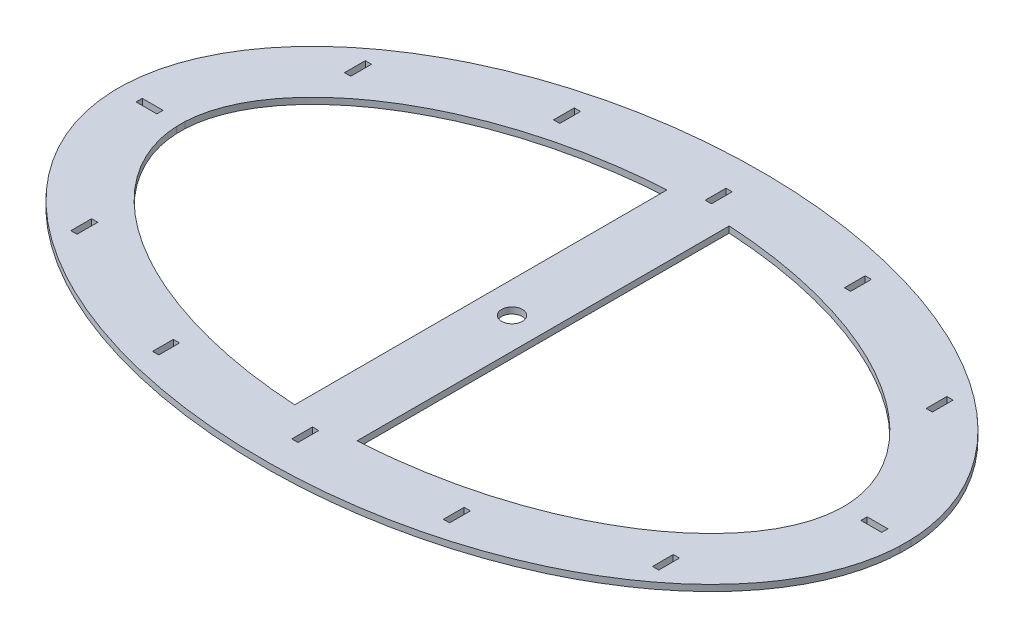
from build123d import *

# Parameters (mm, degrees)
SKETCH_1_R          = 5
EXTRUDE_1_DEPTH     = 3
SKETCH_2_W          = 3
SKETCH_2_H          = 10
SKETCH_2_W_2        = 10
SKETCH_2_H_2        = 3
CUT_EXTRUDE_1_DEPTH = 225.320807502


with BuildPart() as part:
    # 草图1 → 凸台-拉伸1 (new body)
    # profile 1 of 2: a face of its own
    with BuildSketch(Plane(origin=(0, 0, 0), x_dir=(1, 0, 0), z_dir=(0, 1, 0))):
        with BuildLine():
            Line((-189.5, 2.67807522), (-189.5, -2.67807522))
            add(Edge.make_bspline(
                [(-189.5, -2.67807522), (-189.403013737, -5.4287659), (-188.913529521, -11.280436832), (-187.184797767, -20.477000703), (-182.901604371, -32.558534689), (-176.518140993, -44.473382271), (-168.370672682, -55.661029172), (-158.816512899, -65.937496211), (-145.622389947, -77.408485785), (-128.233359888, -89.122185343), (-106.405311843, -100.093014988), (-80.328404186, -109.345622083), (-53.415456511, -115.716654886), (-26.01245021, -119.406694681), (1.612249886, -120.52669773), (29.223526803, -119.1102282), (56.584216313, -115.114894197), (83.419619157, -108.420073225), (109.201033267, -98.876697436), (130.527468144, -87.756954706), (147.425203381, -76.001107817), (160.172847856, -64.598888808), (169.450747209, -54.337956503), (177.420154922, -43.019542435), (183.422267467, -31.306804293), (187.385215446, -19.571139093), (188.958191111, -10.7853005), (189.405454524, -5.359541143), (189.5, -2.67807522)],
                knots=[0, 0, 0, 0, 0, 0.022605252, 0.048189512, 0.076525509, 0.104866865, 0.133209133, 0.161552255, 0.191528088, 0.248214577, 0.304901251, 0.361587924, 0.418274582, 0.474961249, 0.531647919, 0.588334591, 0.645021247, 0.701707888, 0.758394507, 0.813600526, 0.841943986, 0.87028688, 0.898629863, 0.926970611, 0.955317967, 0.977963639, 1, 1, 1, 1, 1], degree=4))
            Line((189.5, -2.67807522), (189.5, 2.67807522))
            add(Edge.make_bspline(
                [(-189.5, 2.67807522), (-189.403013737, 5.4287659), (-188.913529521, 11.280436832), (-187.184797767, 20.477000703), (-182.901604371, 32.558534689), (-176.518140993, 44.473382271), (-168.370672682, 55.661029172), (-158.816512899, 65.937496211), (-145.622389947, 77.408485785), (-128.233359888, 89.122185343), (-106.405311843, 100.093014988), (-80.328404186, 109.345622083), (-53.415456511, 115.716654886), (-26.01245021, 119.406694681), (1.612249886, 120.52669773), (29.223526803, 119.1102282), (56.584216313, 115.114894197), (83.419619157, 108.420073225), (109.201033267, 98.876697436), (130.527468144, 87.756954706), (147.425203381, 76.001107817), (160.172847856, 64.598888808), (169.450747209, 54.337956503), (177.420154922, 43.019542435), (183.422267467, 31.306804293), (187.385215446, 19.571139093), (188.958191111, 10.7853005), (189.405454524, 5.359541143), (189.5, 2.67807522)],
                knots=[0, 0, 0, 0, 0, 0.022605252, 0.048189512, 0.076525509, 0.104866865, 0.133209133, 0.161552255, 0.191528088, 0.248214577, 0.304901251, 0.361587924, 0.418274582, 0.474961249, 0.531647919, 0.588334591, 0.645021247, 0.701707888, 0.758394507, 0.813600526, 0.841943986, 0.87028688, 0.898629863, 0.926970611, 0.955317967, 0.977963639, 1, 1, 1, 1, 1], degree=4))
        make_face()
        with BuildLine():
            Line((159.5, 2.083418932), (159.5, -2.083418932))
            add(Edge.make_bspline(
                [(159.5, -2.083418932), (159.430377933, -3.619846345), (159.139385215, -6.671456978), (157.940786615, -12.816015531), (155.280316673, -20.500519912), (150.2464343, -29.63014035), (141.267593425, -41.375851732), (126.3637498, -54.741405415), (104.515298354, -67.83687478), (80.138153839, -77.866087876), (54.182309112, -84.909390201), (27.304092868, -89.081582998), (-2.6913e-05, -90.462801356), (-27.304083634, -89.081576827), (-54.182312778, -84.909404424), (-80.138151247, -77.866066645), (-104.515130919, -67.836936962), (-126.363664513, -54.74153076), (-141.267763099, -41.375581268), (-150.246208112, -29.630491802), (-155.280421928, -20.500291974), (-157.940686294, -12.816236482), (-159.139431477, -6.671261076), (-159.43038084, -3.619814978), (-159.5, -2.083423638)],
                knots=[0.001568685, 0.001568685, 0.001568685, 0.001568685, 0.017144663, 0.03272064, 0.063872596, 0.095024552, 0.126176507, 0.188480419, 0.25078433, 0.313088241, 0.375392153, 0.437696064, 0.499999976, 0.562303887, 0.624607798, 0.68691171, 0.749215621, 0.811519532, 0.873823444, 0.904975399, 0.936127355, 0.967279311, 0.982855289, 0.998431266, 0.998431266, 0.998431266, 0.998431266], degree=3))
            Line((-159.5, -2.083423638), (-159.5, 2.083423638))
            add(Edge.make_bspline(
                [(-159.5, 2.083423638), (-159.43038084, 3.619814978), (-159.139431477, 6.671261076), (-157.940686294, 12.816236482), (-155.280421928, 20.500291974), (-150.246208112, 29.630491802), (-141.267763099, 41.375581268), (-126.363664513, 54.74153076), (-104.515130919, 67.836936962), (-80.138151247, 77.866066645), (-54.182312778, 84.909404424), (-27.304083634, 89.081576827), (-2.6913e-05, 90.462801356), (27.304092868, 89.081582998), (54.182309112, 84.909390201), (80.138153839, 77.866087876), (104.515298354, 67.83687478), (126.3637498, 54.741405415), (141.267593425, 41.375851732), (150.2464343, 29.63014035), (155.280316673, 20.500519912), (157.940786615, 12.816015531), (159.139385215, 6.671456978), (159.430377933, 3.619846345), (159.5, 2.083418932)],
                knots=[0.001568685, 0.001568685, 0.001568685, 0.001568685, 0.017144663, 0.03272064, 0.063872596, 0.095024552, 0.126176507, 0.188480419, 0.25078433, 0.313088241, 0.375392153, 0.437696064, 0.499999976, 0.562303887, 0.624607798, 0.68691171, 0.749215621, 0.811519532, 0.873823444, 0.904975399, 0.936127355, 0.967279311, 0.982855289, 0.998431266, 0.998431266, 0.998431266, 0.998431266], degree=3))
        make_face(mode=Mode.SUBTRACT)
    # profile 2 of 2: a face of its own
    with BuildSketch(Plane(origin=(0, 0, 0), x_dir=(1, 0, 0), z_dir=(0, 1, 0))):
        with BuildLine():
            Line((15, -89.584088933), (15, 89.584088933))
            add(Edge.make_bspline(
                [(-15, 89.584087357), (-10.007870789, 89.863221211), (-1.3117e-05, 90.141566253), (10.007857262, 89.863223114), (15, 89.584088933)],
                knots=[0.465745288, 0.465745288, 0.465745288, 0.465745288, 0.499999976, 0.534254707, 0.534254707, 0.534254707, 0.534254707], degree=3))
            Line((-15, 89.584087357), (-15, -89.584087357))
            add(Edge.make_bspline(
                [(15, -89.584088933), (10.007857262, -89.863223114), (-1.3117e-05, -90.141566253), (-10.007870789, -89.863221211), (-15, -89.584087357)],
                knots=[0.465745244, 0.465745244, 0.465745244, 0.465745244, 0.499999976, 0.534254663, 0.534254663, 0.534254663, 0.534254663], degree=3))
        make_face()
        with Locations(Location((0, 0, 0), (0, 0, 270))):
            Circle(SKETCH_1_R, mode=Mode.SUBTRACT)
    extrude(amount=EXTRUDE_1_DEPTH)

    # 草图2 → 切除-拉伸1 (cut, through all)
    with BuildSketch(Plane(origin=(0, 3, 0), x_dir=(1, 0, 0), z_dir=(0, 1, 0))):
        with Locations((140, -65.874036058)):
            Rectangle(SKETCH_2_W, SKETCH_2_H)
        with Locations((174.473517333, -0.002394208)):
            Rectangle(SKETCH_2_W_2, SKETCH_2_H_2)
        with Locations((140, 65.869247642)):
            Rectangle(SKETCH_2_W, SKETCH_2_H)
        with Locations((70, -96.514031923)):
            Rectangle(SKETCH_2_W, SKETCH_2_H)
        with Locations((70, 96.509243508)):
            Rectangle(SKETCH_2_W, SKETCH_2_H)
        with Locations((0, 99.519533663)):
            Rectangle(SKETCH_2_W, SKETCH_2_H)
        with Locations((0, -99.524322078)):
            Rectangle(SKETCH_2_W, SKETCH_2_H)
        with Locations((-70, -96.514031923)):
            Rectangle(SKETCH_2_W, SKETCH_2_H)
        with Locations((-140, -65.874036058)):
            Rectangle(SKETCH_2_W, SKETCH_2_H)
        with Locations((-174.473517333, -0.002394208)):
            Rectangle(SKETCH_2_W_2, SKETCH_2_H_2)
        with Locations((-140, 65.869247642)):
            Rectangle(SKETCH_2_W, SKETCH_2_H)
        with Locations((-70, 96.509243508)):
            Rectangle(SKETCH_2_W, SKETCH_2_H)
    extrude(amount=-CUT_EXTRUDE_1_DEPTH, mode=Mode.SUBTRACT)


solid = part.part
